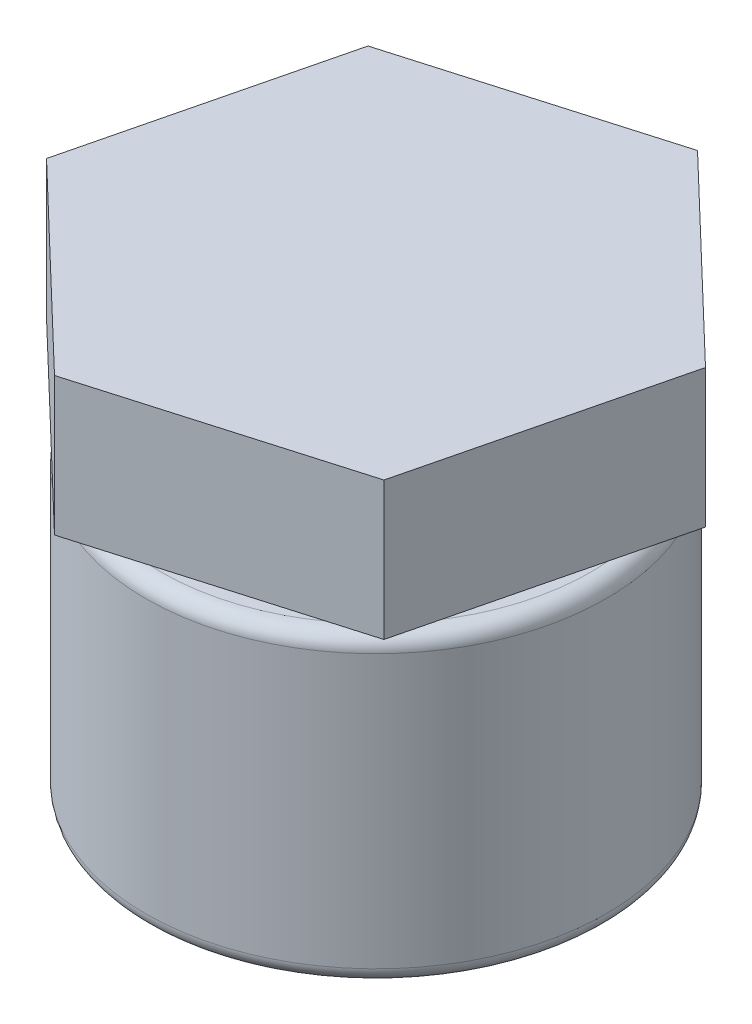
from build123d import *

# Parameters (mm, degrees)
FILLET_1_R      = 10
FILLET_2_R      = 10
EXTRUDE_1_DEPTH = 90


with BuildPart() as part:
    # Эскиз1 → Повернуть1 (revolve)
    with BuildSketch(Plane.XY):
        Polygon((0, 66.542681753), (17.181699008, 66.542681753), (17.181699008, 47.449620601), (28.247878031, 47.449620601), (28.247878031, 9.327244829), (30.100902096, 9.327244829), (30.100902096, 7.134773317), (28.247878031, 7.134773317), (28.247878031, -5.096266655), (149.975847277, -5.096266655), (149.975847277, -202.860033708), (0, -202.860033708), (0, -186.007813089), (141.152083847, -186.007813089), (141.152083847, -11.320160326), (0, -11.320160326), align=None)
    revolve(axis=Axis((0, -11.320160326, 0), (0, 1, 0)))

    # Скругление1
    fillet_1_edges = [part.edges().sort_by_distance(p)[0] for p in [
        (-149.975847277, -5.096266655, 0),
    ]]
    fillet(fillet_1_edges, radius=FILLET_1_R)

    # Скругление2
    fillet_2_edges = [part.edges().sort_by_distance(p)[0] for p in [
        (-149.975847277, -202.860033708, 0),
    ]]
    fillet(fillet_2_edges, radius=FILLET_2_R)


with BuildPart() as body_2:
    # Эскиз2 → Бобышка-Вытянуть1 (new body)
    with BuildSketch(Plane(origin=(0, 9.327244829, 0), x_dir=(1, 0, 0), z_dir=(0, 1, 0))):
        Polygon((-125.022494836, 119.832030249), (-166.288829801, -48.356641448), (-41.266334965, -168.188671697), (125.022494836, -119.832030249), (166.288829801, 48.356641448), (41.266334965, 168.188671697), align=None)
    extrude(amount=EXTRUDE_1_DEPTH)

    # Эскиз1<3> → Вырез-Повернуть1 (revolve, cut)
    with BuildSketch(Plane.XY):
        Polygon((0, 66.542681753), (17.181699008, 66.542681753), (17.181699008, 47.449620601), (28.247878031, 47.449620601), (28.247878031, 9.327244829), (30.100902096, 9.327244829), (30.100902096, 7.134773317), (28.247878031, 7.134773317), (28.247878031, -5.096266655), (149.975847277, -5.096266655), (149.975847277, -202.860033708), (0, -202.860033708), (0, -186.007813089), (141.152083847, -186.007813089), (141.152083847, -11.320160326), (0, -11.320160326), align=None)
    revolve(axis=Axis((0, -11.320160326, 0), (0, 1, 0)), mode=Mode.SUBTRACT)


solid = Compound([part.part, body_2.part])
